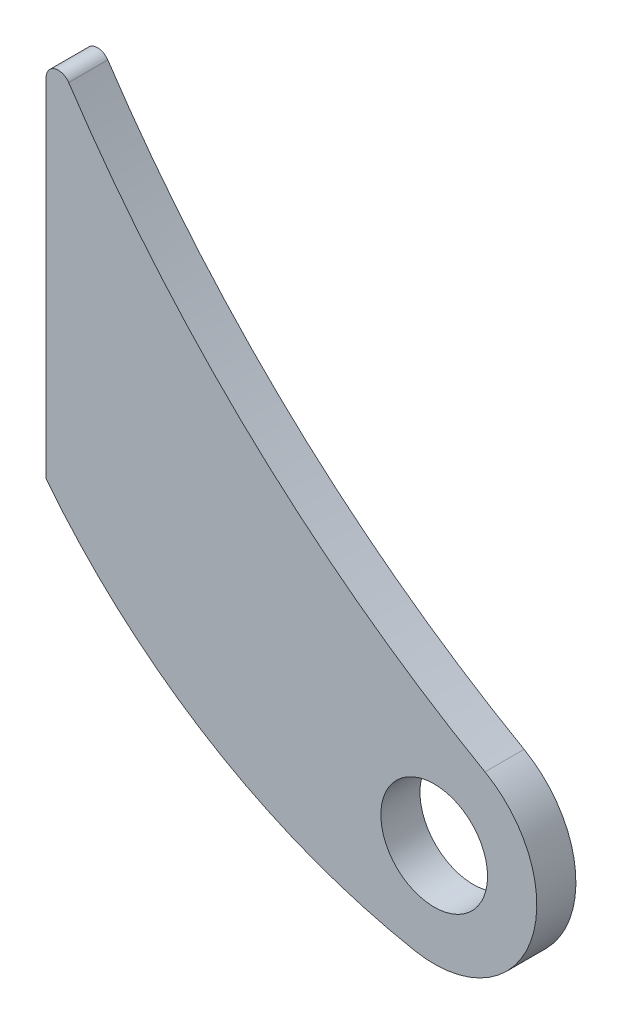
from build123d import *

# Parameters (mm, degrees)
CROQUIS1_R              = 13
SALIENTE_EXTRUIR1_DEPTH = 4.765
REDONDEO2_R             = 3


with BuildPart() as part:
    # Croquis1 → Saliente-Extruir1 (new, symmetric)
    with BuildSketch(Plane.XY):
        with BuildLine():
            Line((-44.5526077, 70.070188004), (-44.5526077, -24.929811996))
            ThreePointArc((-44.5526077, -24.929811996), (-4.556794057, -60.38146366), (45.329796291, -79.559910369))
            ThreePointArc((45.329796291, -79.559910369), (73.459258652, -63.640786047), (62.376657562, -33.278620035))
            ThreePointArc((62.376657562, -33.278620035), (2.406760274, 11.66514835), (-44.5526077, 70.070188004))
        make_face()
        with Locations((50, -55)):
            Circle(CROQUIS1_R, mode=Mode.SUBTRACT)
    extrude(amount=SALIENTE_EXTRUIR1_DEPTH, both=True)

    # Redondeo2
    redondeo2_edges = [part.edges().sort_by_distance(p)[0] for p in [
        (-44.5526077, 70.070188004, 0),
    ]]
    fillet(redondeo2_edges, radius=REDONDEO2_R)


solid = part.part
